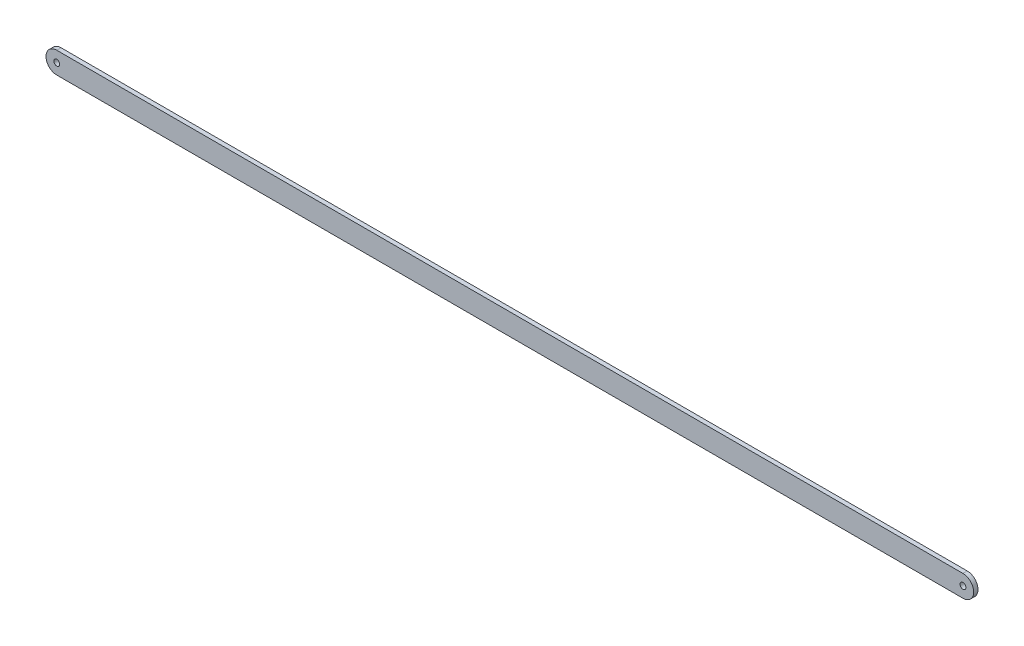
from build123d import *

# Parameters (mm, degrees)
SKETCH1_R           = 2.75
BOSS_EXTRUDE1_DEPTH = 4


with BuildPart() as part:
    # Sketch1 → Boss-Extrude1 (new body)
    with BuildSketch(Plane.XY):
        with BuildLine():
            Line((-421.355, -10), (421.355, -10))
            ThreePointArc((421.355, -10), (431.355, 0), (421.355, 10))
            Line((421.355, 10), (-421.355, 10))
            ThreePointArc((-421.355, 10), (-431.355, 0), (-421.355, -10))
        make_face()
        with Locations((-421.355, 0)):
            Circle(SKETCH1_R, mode=Mode.SUBTRACT)
        with Locations(Location((421.355, 0, 0), (0, 0, 180))):
            Circle(SKETCH1_R, mode=Mode.SUBTRACT)
    extrude(amount=BOSS_EXTRUDE1_DEPTH)


solid = part.part
